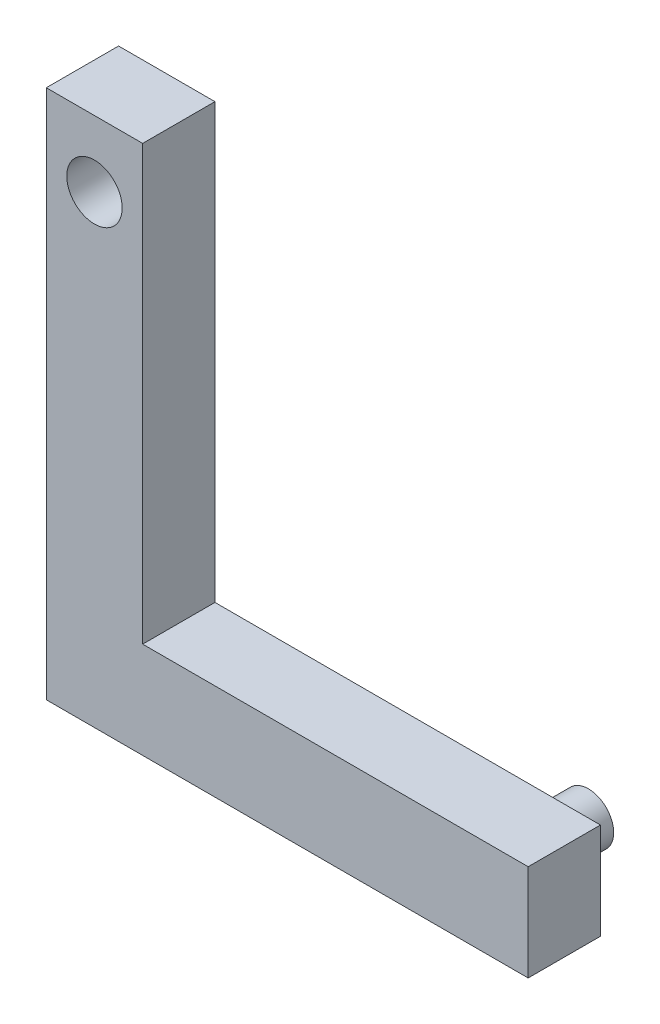
from build123d import *

# Parameters (mm, degrees)
CROQUIS1_W              = 20
CROQUIS1_H              = 4
SALIENTE_EXTRUIR1_DEPTH = 3
CROQUIS5_W              = 4
CROQUIS5_H              = 18
SALIENTE_EXTRUIR2_DEPTH = 3
CROQUIS5_5_R            = 1.15
CORTAR_EXTRUIR3_DEPTH   = 28.073972741
CROQUIS3_R              = 1.05
SALIENTE_EXTRUIR4_DEPTH = 2
CROQUIS3_2_R            = 1.05
SALIENTE_EXTRUIR5_DEPTH = 2


with BuildPart() as part:
    # Croquis1 → Saliente-Extruir1 (new body)
    with BuildSketch(Plane.XY):
        with Locations((10, -2)):
            Rectangle(CROQUIS1_W, CROQUIS1_H)
    extrude(amount=SALIENTE_EXTRUIR1_DEPTH)

    # Croquis5 → Saliente-Extruir2 (add)
    with BuildSketch(Plane.XY.offset(3)):
        with Locations((2, 9)):
            Rectangle(CROQUIS5_W, CROQUIS5_H)
    extrude(amount=-SALIENTE_EXTRUIR2_DEPTH)

    # Croquis5<5> → Cortar-Extruir3 (cut, through all)
    with BuildSketch(Plane.XY.offset(3)):
        with Locations((2, 15.25)):
            Circle(CROQUIS5_5_R)
    extrude(amount=-CORTAR_EXTRUIR3_DEPTH, mode=Mode.SUBTRACT)

    # Croquis3 → Saliente-Extruir4 (add)
    with BuildSketch(Plane(origin=(0, 0, 0), x_dir=(-1, 0, 0), z_dir=(0, 0, -1))):
        with Locations((-17.5, -2)):
            Circle(CROQUIS3_R)
    extrude(amount=-SALIENTE_EXTRUIR4_DEPTH)

    # Croquis3<2> → Saliente-Extruir5 (add)
    with BuildSketch(Plane(origin=(0, 0, 0), x_dir=(-1, 0, 0), z_dir=(0, 0, -1))):
        with Locations((-17.5, -2)):
            Circle(CROQUIS3_2_R)
    extrude(amount=SALIENTE_EXTRUIR5_DEPTH)


solid = part.part
